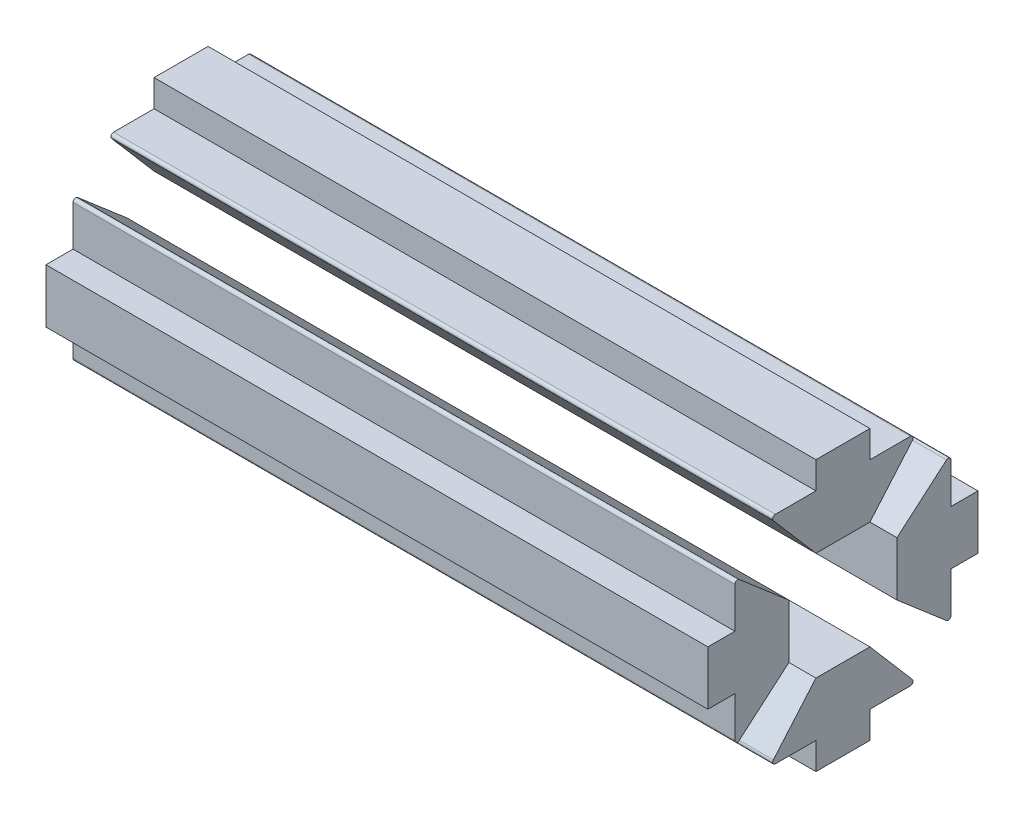
from build123d import *

# Parameters (mm, degrees)
SKETCH10_W          = 2.54
SKETCH10_H          = 5.08
SKETCH10_W_2        = 5.08
SKETCH10_H_2        = 2.54
BOSS_EXTRUDE3_DEPTH = 62.23


with BuildPart() as part:
    # Sketch10 → Boss-Extrude3 (new body)
    with BuildSketch(Plane(origin=(0, 0, 0), x_dir=(0, 0, -1), z_dir=(1, 0, 0))):
        with Locations((-11.43, 0)):
            Rectangle(SKETCH10_W, SKETCH10_H)
        with BuildLine():
            Line((-5.08, 2.54), (-9.740509205, 6.542688341))
            ThreePointArc((-9.740509205, 6.542688341), (-10.012022021, 6.580814495), (-10.16, 6.35))
            Line((-10.16, 6.35), (-10.16, -6.35))
            ThreePointArc((-10.16, -6.35), (-10.012022021, -6.580814495), (-9.740509205, -6.542688341))
            Line((-9.740509205, -6.542688341), (-5.08, -2.54))
            Line((-5.08, -2.54), (-5.08, 2.54))
        make_face()
        with BuildLine():
            Line((6.35, 10.16), (-6.35, 10.16))
            ThreePointArc((-6.35, 10.16), (-6.580814495, 10.012022021), (-6.542688341, 9.740509205))
            Line((-6.542688341, 9.740509205), (-2.54, 5.08))
            Line((-2.54, 5.08), (2.54, 5.08))
            Line((2.54, 5.08), (6.542688341, 9.740509205))
            ThreePointArc((6.542688341, 9.740509205), (6.580814495, 10.012022021), (6.35, 10.16))
        make_face()
        with Locations((0, 11.43)):
            Rectangle(SKETCH10_W_2, SKETCH10_H_2)
        with BuildLine():
            ThreePointArc((6.542688341, -9.740509205), (6.580814495, -10.012022021), (6.35, -10.16))
            Line((6.35, -10.16), (-6.35, -10.16))
            ThreePointArc((-6.35, -10.16), (-6.580814495, -10.012022021), (-6.542688341, -9.740509205))
            Line((-6.542688341, -9.740509205), (-2.54, -5.08))
            Line((-2.54, -5.08), (2.54, -5.08))
            Line((2.54, -5.08), (6.542688341, -9.740509205))
        make_face()
        with Locations((0, -11.43)):
            Rectangle(SKETCH10_W_2, SKETCH10_H_2)
        with BuildLine():
            Line((5.08, 2.54), (5.08, -2.54))
            Line((5.08, -2.54), (9.740509205, -6.542688341))
            ThreePointArc((9.740509205, -6.542688341), (10.012022021, -6.580814495), (10.16, -6.35))
            Line((10.16, -6.35), (10.16, -2.54))
            Line((10.16, -2.54), (10.16, 2.54))
            Line((10.16, 2.54), (10.16, 6.35))
            ThreePointArc((10.16, 6.35), (10.012022021, 6.580814495), (9.740509205, 6.542688341))
            Line((9.740509205, 6.542688341), (5.08, 2.54))
        make_face()
        with Locations((11.43, 0)):
            Rectangle(SKETCH10_W, SKETCH10_H)
    extrude(amount=-BOSS_EXTRUDE3_DEPTH)


solid = part.part
